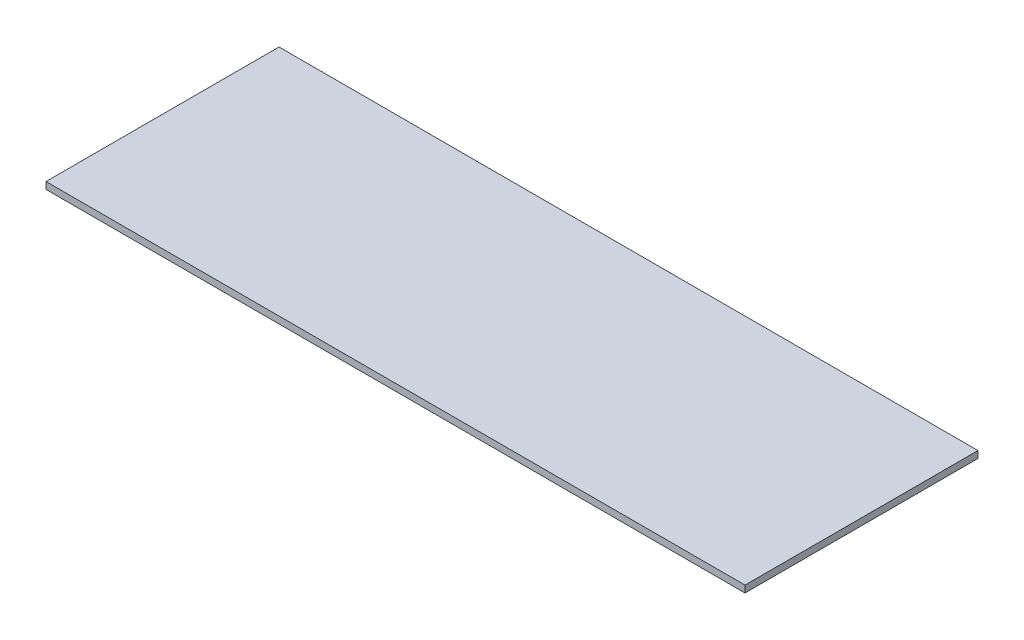
from build123d import *

# Parameters (mm, degrees)
SKETCH1_W           = 609.6
SKETCH1_H           = 203.2
BOSS_EXTRUDE1_DEPTH = 6


with BuildPart() as part:
    # Sketch1 → Boss-Extrude1 (new body)
    with BuildSketch(Plane(origin=(0, 0, 0), x_dir=(1, 0, 0), z_dir=(0, 1, 0))):
        Rectangle(SKETCH1_W, SKETCH1_H)
    extrude(amount=BOSS_EXTRUDE1_DEPTH)


solid = part.part
